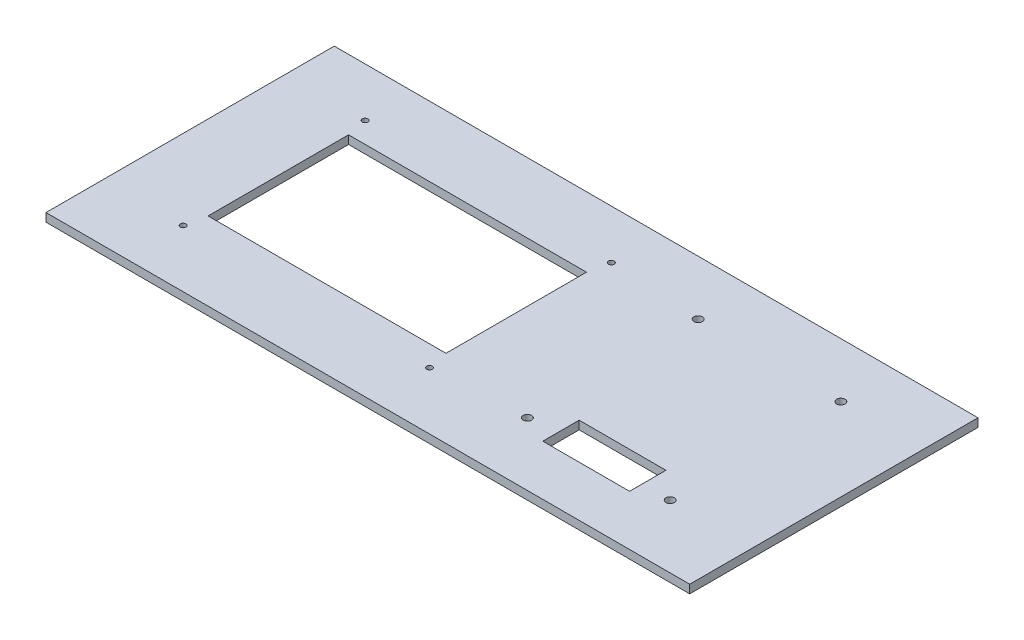
from build123d import *

# Parameters (mm, degrees)
SKETCH1_W           = 230
SKETCH1_H           = 103
BOSS_EXTRUDE1_DEPTH = 3
SKETCH2_W           = 85
SKETCH2_H           = 50.2
CUT_EXTRUDE1_DEPTH  = 3
SKETCH3_R           = 1.5
SKETCH3_W           = 31.00355617
SKETCH3_H           = 13
CUT_EXTRUDE2_DEPTH  = 3
SKETCH4_R           = 1
CUT_EXTRUDE3_DEPTH  = 3


with BuildPart() as part:
    # Sketch1 → Boss-Extrude1 (new body)
    with BuildSketch(Plane(origin=(0, 0, 0), x_dir=(1, 0, 0), z_dir=(0, 1, 0))):
        with Locations((2.626404494, 17.846910112)):
            Rectangle(SKETCH1_W, SKETCH1_H)
    extrude(amount=BOSS_EXTRUDE1_DEPTH)

    # Sketch2 → Cut-Extrude1 (cut)
    with BuildSketch(Plane(origin=(0, 3, 0), x_dir=(1, 0, 0), z_dir=(0, 1, 0))):
        with Locations((-39.873595506, 19.346910112)):
            Rectangle(SKETCH2_W, SKETCH2_H)
    extrude(amount=-CUT_EXTRUDE1_DEPTH, mode=Mode.SUBTRACT)

    # Sketch3 → Cut-Extrude2 (cut)
    with BuildSketch(Plane(origin=(0, 3, 0), x_dir=(1, 0, 0), z_dir=(0, 1, 0))):
        with Locations(Location((37.126404494, 49.846910112, 0), (0, 0, 270))):
            Circle(SKETCH3_R)
        with Locations(Location((88.126404494, 49.846910112, 0), (0, 0, 270))):
            Circle(SKETCH3_R)
        with Locations(Location((88.126404494, -11.153089888, 0), (0, 0, 270))):
            Circle(SKETCH3_R)
        with Locations(Location((37.126404494, -11.153089888, 0), (0, 0, 270))):
            Circle(SKETCH3_R)
        with Locations((62.624626409, -9.153089888)):
            Rectangle(SKETCH3_W, SKETCH3_H)
    extrude(amount=-CUT_EXTRUDE2_DEPTH, mode=Mode.SUBTRACT)

    # Sketch4 → Cut-Extrude3 (cut)
    with BuildSketch(Plane(origin=(0, 3, 0), x_dir=(1, 0, 0), z_dir=(0, 1, 0))):
        with Locations(Location((-83.873595506, 51.846910112, 0), (0, 0, 270))):
            Circle(SKETCH4_R)
        with Locations(Location((4.126404494, 51.846910112, 0), (0, 0, 270))):
            Circle(SKETCH4_R)
        with Locations(Location((-83.873595506, -13.153089888, 0), (0, 0, 270))):
            Circle(SKETCH4_R)
        with Locations(Location((4.126404494, -13.153089888, 0), (0, 0, 270))):
            Circle(SKETCH4_R)
    extrude(amount=-CUT_EXTRUDE3_DEPTH, mode=Mode.SUBTRACT)


solid = part.part
